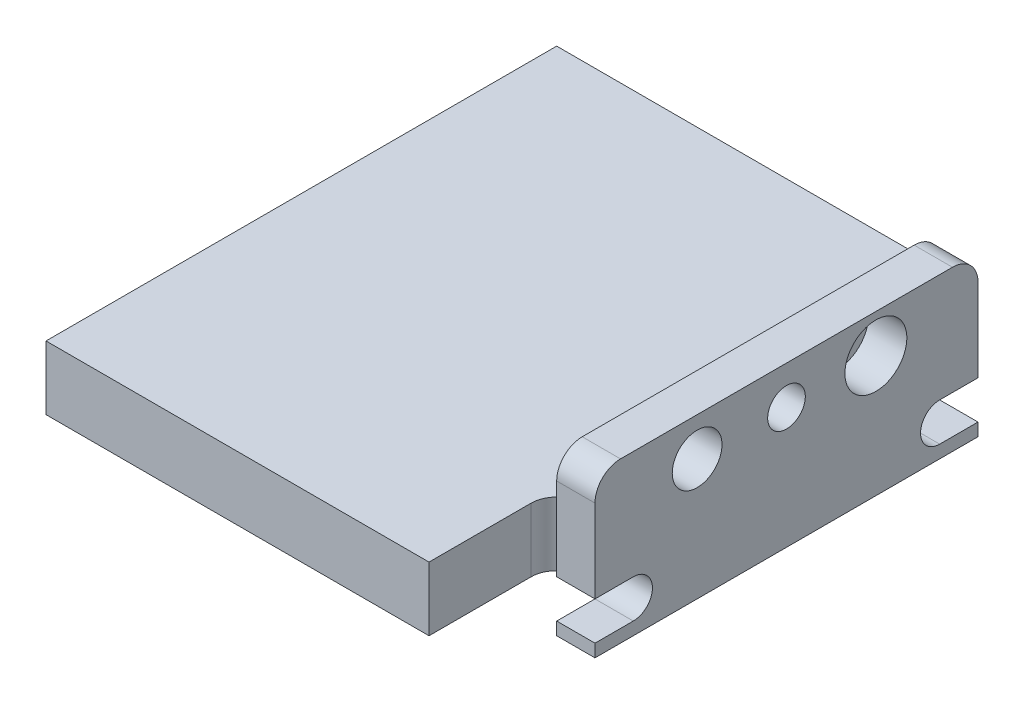
from build123d import *

# Parameters (mm, degrees)
SKETCH_1_W          = 20
SKETCH_1_H          = 5
EXTRUDE_1_DEPTH     = 35
SKETCH_2_W          = 30
SKETCH_2_H          = 20
EXTRUDE_2_DEPTH     = 3
FILLET_1_R          = 2
FILLET_2_R          = 2
FILLET_3_R          = 2
FILLET_4_R          = 2
SKETCH_4_W          = 30
SKETCH_4_H          = 40
EXTRUDE_3_DEPTH     = 2.5
FILLET_5_R          = 2
FILLET_6_R          = 2
CUT_EXTRUDE_2_DEPTH = 3
SKETCH_6_R          = 1.475
SKETCH_6_R_2        = 1.95
SKETCH_6_R_3        = 2.425
CUT_EXTRUDE_3_DEPTH = 3
SKETCH_8_W          = 3
SKETCH_8_H          = 7.5
CUT_EXTRUDE_4_DEPTH = 30


with BuildPart() as part:
    # 草图1 → 凸台-拉伸1 (new body)
    with BuildSketch(Plane(origin=(0, 0, 0), x_dir=(0, 0, -1), z_dir=(1, 0, 0))):
        Rectangle(SKETCH_1_W, SKETCH_1_H)
    extrude(amount=-EXTRUDE_1_DEPTH)

    # 草图2 → 凸台-拉伸2 (add)
    with BuildSketch(Plane(origin=(0, 0, 0), x_dir=(0, 0, -1), z_dir=(1, 0, 0))):
        Rectangle(SKETCH_2_W, SKETCH_2_H)
    extrude(amount=EXTRUDE_2_DEPTH)

    # 圆角1
    fillet_1_edges = [part.edges().sort_by_distance(p)[0] for p in [
        (1.5, 10, -15),
    ]]
    fillet(fillet_1_edges, radius=FILLET_1_R)

    # 圆角2
    fillet_2_edges = [part.edges().sort_by_distance(p)[0] for p in [
        (1.5, 10, 15),
    ]]
    fillet(fillet_2_edges, radius=FILLET_2_R)

    # 圆角3
    fillet_3_edges = [part.edges().sort_by_distance(p)[0] for p in [
        (1.5, -10, -15),
    ]]
    fillet(fillet_3_edges, radius=FILLET_3_R)

    # 圆角4
    fillet_4_edges = [part.edges().sort_by_distance(p)[0] for p in [
        (1.5, -10, 15),
    ]]
    fillet(fillet_4_edges, radius=FILLET_4_R)

    # 草图4 → 凸台-拉伸3 (add, symmetric)
    with BuildSketch(Plane(origin=(0, 0, 0), x_dir=(1, 0, 0), z_dir=(0, 1, 0))):
        with Locations((-20, 0)):
            Rectangle(SKETCH_4_W, SKETCH_4_H)
    extrude(amount=EXTRUDE_3_DEPTH, both=True)

    # 圆角5
    fillet_5_edges = [part.edges().sort_by_distance(p)[0] for p in [
        (-5, 0, -10),
    ]]
    fillet(fillet_5_edges, radius=FILLET_5_R)

    # 圆角6
    fillet_6_edges = [part.edges().sort_by_distance(p)[0] for p in [
        (-5, 0, 10),
    ]]
    fillet(fillet_6_edges, radius=FILLET_6_R)

    # 草图5 → 切除-拉伸2 (cut)
    with BuildSketch(Plane(origin=(0, 0, 0), x_dir=(0, 0, -1), z_dir=(1, 0, 0))):
        with BuildLine():
            Line((-12, -1.5), (-15, -1.5))
            Line((-15, -1.5), (-15, 1.5))
            Line((-15, 1.5), (-12, 1.5))
            ThreePointArc((-12, 1.5), (-10.5, 0), (-12, -1.5))
        make_face()
        with BuildLine():
            Line((12, 1.5), (15, 1.5))
            Line((15, 1.5), (15, -1.5))
            Line((15, -1.5), (12, -1.5))
            ThreePointArc((12, -1.5), (10.5, 0), (12, 1.5))
        make_face()
    extrude(amount=CUT_EXTRUDE_2_DEPTH, mode=Mode.SUBTRACT)

    # 草图6 → 切除-拉伸3 (cut)
    with BuildSketch(Plane(origin=(0, 0, 0), x_dir=(0, 0, -1), z_dir=(1, 0, 0))):
        with Locations((0, -7)):
            Circle(SKETCH_6_R)
        with Locations((-7, -7)):
            Circle(SKETCH_6_R_2)
        with Locations((7, -7)):
            Circle(SKETCH_6_R_3)
        with Locations(Location((7, 7, 0), (0, 0, 180))):
            Circle(SKETCH_6_R_3)
        with Locations(Location((0, 7, 0), (0, 0, 180))):
            Circle(SKETCH_6_R)
        with Locations(Location((-7, 7, 0), (0, 0, 180))):
            Circle(SKETCH_6_R_2)
    extrude(amount=CUT_EXTRUDE_3_DEPTH, mode=Mode.SUBTRACT)

    # 草图8 → 切除-拉伸4 (cut)
    with BuildSketch(Plane(origin=(0, 0, -15), x_dir=(-1, 0, 0), z_dir=(0, 0, -1))):
        with Locations((-1.5, -6.25)):
            Rectangle(SKETCH_8_W, SKETCH_8_H)
    extrude(amount=-CUT_EXTRUDE_4_DEPTH, mode=Mode.SUBTRACT)


solid = part.part
